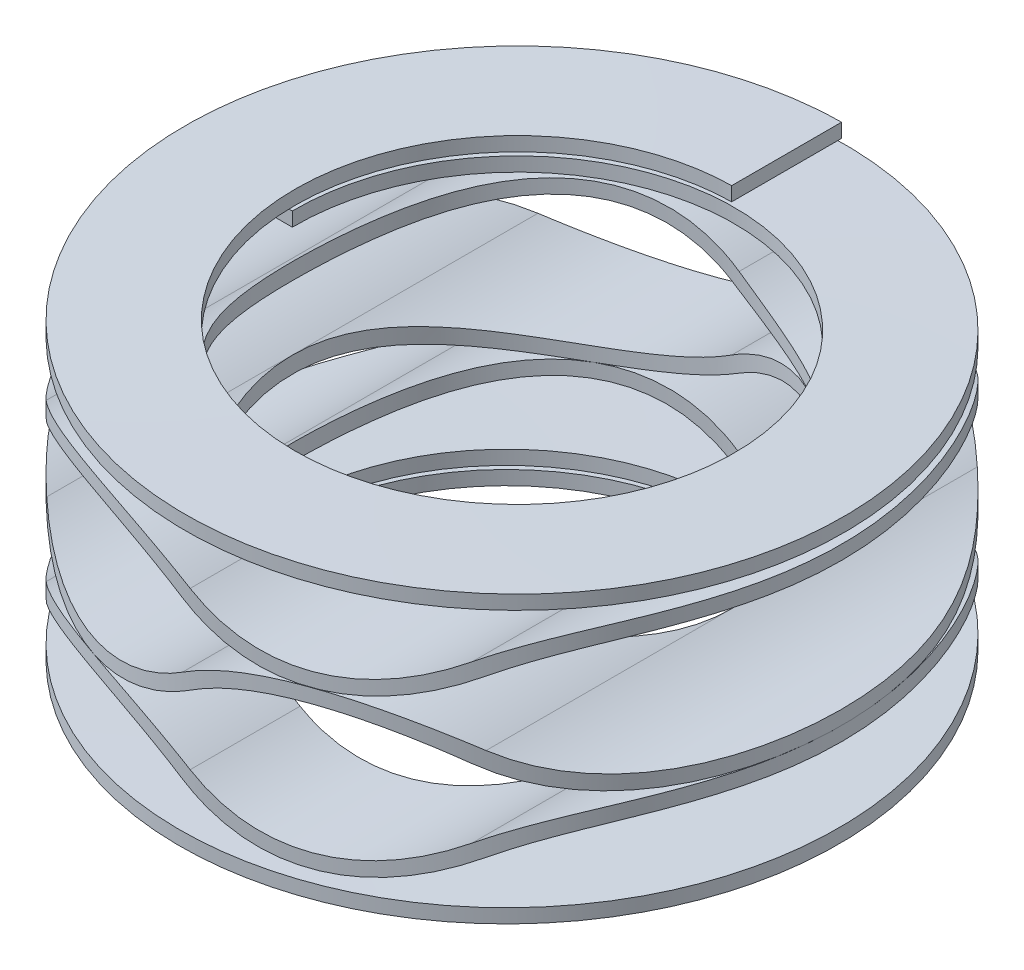
from build123d import *

# Parameters (mm, degrees)
SURFACE_EXTRUDE1_2_BACK  = 4.7625
SURFACE_EXTRUDE1_2_DEPTH = 9.525
SURFACE_EXTRUDE1_3_BACK  = 4.7625
SURFACE_EXTRUDE1_3_DEPTH = 9.525
SURFACE_EXTRUDE1_5_BACK  = 4.7625
SURFACE_EXTRUDE1_5_DEPTH = 9.525
THICKEN1_T1              = 0.2032
LPATTERN1_COUNT          = 3
LPATTERN1_PITCH          = 2.269066667
CUT_EXTRUDE1_DEPTH       = 9.451504106
CUT_EXTRUDE1_DEPTH_BACK  = 9.451504106
SKETCH4_OUTSIDE_W        = 14.543
SKETCH4_OUTSIDE_H        = 14.542
SKETCH4_OUTSIDE_R        = 4.7625
CUT_EXTRUDE2_DEPTH       = 9.451504307
CUT_EXTRUDE2_DEPTH_BACK  = 9.451504307
SKETCH5_R                = 3.175
CUT_EXTRUDE3_DEPTH       = 9.451504307
CUT_EXTRUDE3_DEPTH_BACK  = 9.451504307
SKETCH6_OUTSIDE_W        = 14.544
SKETCH6_OUTSIDE_H        = 11.825
SKETCH6_OUTSIDE_W_2      = 9.525
SKETCH6_OUTSIDE_H_2      = 3.4036
SWEEP1_PITCH             = 0.254
SWEEP1_HEIGHT            = 0.3175
SWEEP1_RADIUS            = 3.96875
SWEEP1_START_ANGLE       = -90
SKETCH8_W                = 1.5875
SKETCH8_H                = 0.2032


with BuildPart() as body_1:
    # Surface-Extrude1: a surface, the sketch's curves swept straight by 9.525 mm
    with BuildLine(Plane.XY.offset(-SURFACE_EXTRUDE1_2_BACK), mode=Mode.PRIVATE) as surface_extrude1_2_path:
        ThreePointArc((-4.7625, -1.7018), (-3.935305692, -1.582981354), (-3.175, -1.236133333))
        ThreePointArc((-3.175, -1.236133333), (-2.414694308, -0.889285313), (-1.5875, -0.770466667))
    surface_extrude1_2 = Shell.extrude(surface_extrude1_2_path.wire(), (0 * SURFACE_EXTRUDE1_2_DEPTH, 0 * SURFACE_EXTRUDE1_2_DEPTH, 1 * SURFACE_EXTRUDE1_2_DEPTH))
    # Surface-Extrude1: a surface, the sketch's curves swept straight by 9.525 mm
    with BuildLine(Plane.XY.offset(-SURFACE_EXTRUDE1_3_BACK), mode=Mode.PRIVATE) as surface_extrude1_3_path:
        ThreePointArc((-4.7625, -1.7018), (-3.935305692, -1.582981354), (-3.175, -1.236133333))
        ThreePointArc((-3.175, -1.236133333), (-2.414694308, -0.889285313), (-1.5875, -0.770466667))
    surface_extrude1_3 = Shell.extrude(surface_extrude1_3_path.wire(), (0 * SURFACE_EXTRUDE1_3_DEPTH, 0 * SURFACE_EXTRUDE1_3_DEPTH, 1 * SURFACE_EXTRUDE1_3_DEPTH))
    # Mirror1: that surface mirrored
    mirror1_4 = surface_extrude1_3.mirror(Plane(origin=(-1.5875, 0, 0), x_dir=(0, 0, 1), z_dir=(1, 0, 0)))
    # Surface-Extrude1: a surface, the sketch's curves swept straight by 9.525 mm
    with BuildLine(Plane.XY.offset(-SURFACE_EXTRUDE1_5_BACK), mode=Mode.PRIVATE) as surface_extrude1_5_path:
        ThreePointArc((-4.7625, -1.7018), (-3.935305692, -1.582981354), (-3.175, -1.236133333))
        ThreePointArc((-3.175, -1.236133333), (-2.414694308, -0.889285313), (-1.5875, -0.770466667))
    surface_extrude1_5 = Shell.extrude(surface_extrude1_5_path.wire(), (0 * SURFACE_EXTRUDE1_5_DEPTH, 0 * SURFACE_EXTRUDE1_5_DEPTH, 1 * SURFACE_EXTRUDE1_5_DEPTH))
    # Mirror1: that surface mirrored
    mirror1_6 = surface_extrude1_5.mirror(Plane(origin=(-1.5875, 0, 0), x_dir=(0, 0, 1), z_dir=(1, 0, 0)))
    # Mirror2: that surface mirrored
    mirror2_7 = mirror1_6.mirror(Plane(origin=(1.5875, 0, 0), x_dir=(0, 0, 1), z_dir=(1, 0, 0)))
    # Surface-Knit1: the surfaces knitted into one
    surface_knit1_1 = Shell(Face.sew_faces(surface_extrude1_2.faces() + mirror1_4.faces() + mirror2_7.faces())[0])
    add(Solid.thicken(surface_knit1_1, THICKEN1_T1))


with BuildPart() as body_2:
    # Mirror3: mirrored copy
    add(body_1.part.mirror(Plane.ZX.offset(-0.567266667)))


with BuildPart() as lpattern1_1:
    # LPattern1: pattern copy
    add(body_1.part.moved(Location(Vector(0, 1, 0) * (1 * LPATTERN1_PITCH))))


with BuildPart() as lpattern1_2:
    # LPattern1: pattern copy
    add(body_1.part.moved(Location(Vector(0, 1, 0) * (2 * LPATTERN1_PITCH))))


with BuildPart() as lpattern1_3:
    # LPattern1: pattern copy
    add(body_2.part.moved(Location(Vector(0, 1, 0) * (1 * LPATTERN1_PITCH))))


with BuildPart() as lpattern1_4:
    # LPattern1: pattern copy
    add(body_2.part.moved(Location(Vector(0, 1, 0) * (2 * LPATTERN1_PITCH))))


with BuildPart() as cut_extrude1_tool:
    # Sketch4 outside → Cut-Extrude1 (new, two sides: drawn at the far end of the back side and taken through both)
    with BuildSketch(Plane(origin=(0, 0, 0), x_dir=(1, 0, 0), z_dir=(0, 1, 0)).offset(-CUT_EXTRUDE1_DEPTH_BACK)):
        with Locations((0.0005, 0)):
            Rectangle(SKETCH4_OUTSIDE_W, SKETCH4_OUTSIDE_H)
        with Locations(Location((0, 0, 0), (0, 0, 270))):
            Circle(SKETCH4_OUTSIDE_R, mode=Mode.SUBTRACT)
    extrude(amount=CUT_EXTRUDE1_DEPTH + CUT_EXTRUDE1_DEPTH_BACK)


with BuildPart() as body_1_1:
    add(body_1.part)

    # Cut-Extrude1: cut by cut_extrude1_tool
    add(cut_extrude1_tool.part, mode=Mode.SUBTRACT)


with BuildPart() as body_2_1:
    add(body_2.part)

    # Cut-Extrude1: cut by cut_extrude1_tool
    add(cut_extrude1_tool.part, mode=Mode.SUBTRACT)


with BuildPart() as lpattern1_1_1:
    add(lpattern1_1.part)

    # Cut-Extrude1: cut by cut_extrude1_tool
    add(cut_extrude1_tool.part, mode=Mode.SUBTRACT)


with BuildPart() as lpattern1_2_1:
    add(lpattern1_2.part)

    # Cut-Extrude1: cut by cut_extrude1_tool
    add(cut_extrude1_tool.part, mode=Mode.SUBTRACT)


with BuildPart() as lpattern1_3_1:
    add(lpattern1_3.part)

    # Cut-Extrude1: cut by cut_extrude1_tool
    add(cut_extrude1_tool.part, mode=Mode.SUBTRACT)


with BuildPart() as lpattern1_4_1:
    add(lpattern1_4.part)

    # Cut-Extrude1: cut by cut_extrude1_tool
    add(cut_extrude1_tool.part, mode=Mode.SUBTRACT)


with BuildPart() as cut_extrude2_tool:
    # Sketch5 → Cut-Extrude2 (new, two sides: drawn at the far end of the back side and taken through both)
    with BuildSketch(Plane(origin=(0, 0, 0), x_dir=(1, 0, 0), z_dir=(0, 1, 0)).offset(-CUT_EXTRUDE2_DEPTH_BACK)):
        with Locations(Location((0, 0, 0), (0, 0, 270))):
            Circle(SKETCH5_R)
    extrude(amount=CUT_EXTRUDE2_DEPTH + CUT_EXTRUDE2_DEPTH_BACK)


with BuildPart() as body_1_2:
    add(body_1_1.part)

    # Cut-Extrude2: cut by cut_extrude2_tool
    add(cut_extrude2_tool.part, mode=Mode.SUBTRACT)


with BuildPart() as body_2_2:
    add(body_2_1.part)

    # Cut-Extrude2: cut by cut_extrude2_tool
    add(cut_extrude2_tool.part, mode=Mode.SUBTRACT)


with BuildPart() as lpattern1_1_2:
    add(lpattern1_1_1.part)

    # Cut-Extrude2: cut by cut_extrude2_tool
    add(cut_extrude2_tool.part, mode=Mode.SUBTRACT)


with BuildPart() as lpattern1_2_2:
    add(lpattern1_2_1.part)

    # Cut-Extrude2: cut by cut_extrude2_tool
    add(cut_extrude2_tool.part, mode=Mode.SUBTRACT)


with BuildPart() as lpattern1_3_2:
    add(lpattern1_3_1.part)

    # Cut-Extrude2: cut by cut_extrude2_tool
    add(cut_extrude2_tool.part, mode=Mode.SUBTRACT)


with BuildPart() as lpattern1_4_2:
    add(lpattern1_4_1.part)

    # Cut-Extrude2: cut by cut_extrude2_tool
    add(cut_extrude2_tool.part, mode=Mode.SUBTRACT)


with BuildPart() as cut_extrude3_tool:
    # Sketch6 outside → Cut-Extrude3 (new, two sides: drawn at the far end of the back side and taken through both)
    with BuildSketch(Plane.XY.offset(-CUT_EXTRUDE3_DEPTH_BACK)):
        with Locations((0, 1.7015)):
            Rectangle(SKETCH6_OUTSIDE_W, SKETCH6_OUTSIDE_H)
        Rectangle(SKETCH6_OUTSIDE_W_2, SKETCH6_OUTSIDE_H_2, mode=Mode.SUBTRACT)
    extrude(amount=CUT_EXTRUDE3_DEPTH + CUT_EXTRUDE3_DEPTH_BACK)


with BuildPart() as lpattern1_2_3:
    add(lpattern1_2_2.part)

    # Cut-Extrude3: cut by cut_extrude3_tool
    add(cut_extrude3_tool.part, mode=Mode.SUBTRACT)


with BuildPart() as lpattern1_3_3:
    add(lpattern1_3_2.part)

    # Cut-Extrude3: cut by cut_extrude3_tool
    add(cut_extrude3_tool.part, mode=Mode.SUBTRACT)


with BuildPart() as lpattern1_4_3:
    add(lpattern1_4_2.part)

    # Cut-Extrude3: cut by cut_extrude3_tool
    add(cut_extrude3_tool.part, mode=Mode.SUBTRACT)


with BuildPart() as body_4:
    # Sweep1: sweep along a helix
    with BuildLine() as sweep1_path:
        add(Helix(SWEEP1_PITCH, SWEEP1_HEIGHT, SWEEP1_RADIUS, center=(0, -1.8034, 0), direction=(0, -1, 0), mode=Mode.PRIVATE).rotate(Axis((0, -1.8034, 0), (0, -1, 0)), SWEEP1_START_ANGLE))
    # Sketch8 → Sweep1 (sweep)
    with BuildSketch(Plane.XY):
        with Locations((-3.96875, -1.8034)):
            Rectangle(SKETCH8_W, SKETCH8_H)
    sweep(path=sweep1_path.line, is_frenet=True)


with BuildPart() as body_5:
    # Mirror4: mirrored copy
    add(body_4.part.mirror(Plane.ZX))


solid = Compound([body_1_2.part, body_2_2.part, lpattern1_1_2.part, body_4.part, body_5.part])
